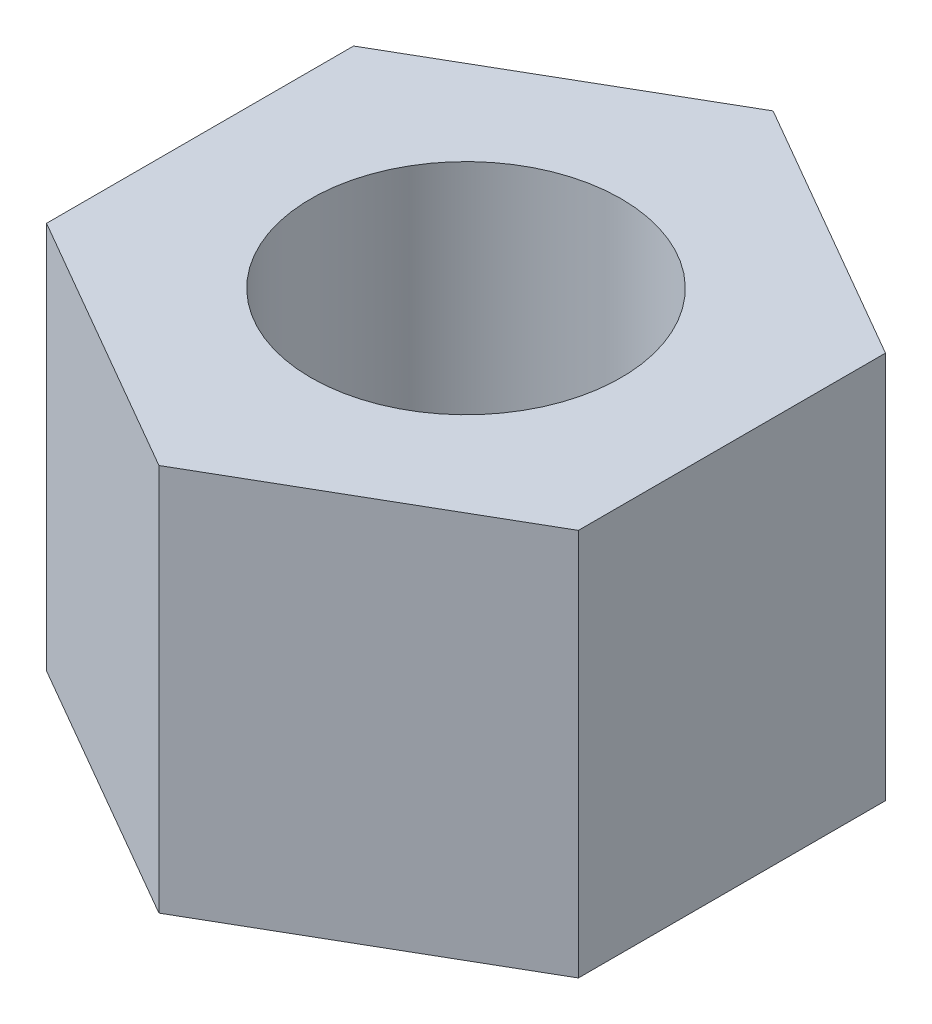
from build123d import *

# Parameters (mm, degrees)
SKETCH_1_R      = 2
EXTRUDE_1_DEPTH = 5


with BuildPart() as part:
    # Эскиз1 → Вытянуть1 (new body)
    with BuildSketch(Plane(origin=(0, 0, 0), x_dir=(1, 0, 0), z_dir=(0, 1, 0))):
        Polygon((0, -3.960622847), (3.43, -1.980311423), (3.43, 1.980311423), (0, 3.960622847), (-3.43, 1.980311423), (-3.43, -1.980311423), align=None)
        with Locations(Location((0, 0, 0), (0, 0, 270))):
            Circle(SKETCH_1_R, mode=Mode.SUBTRACT)
    extrude(amount=EXTRUDE_1_DEPTH)


solid = part.part
